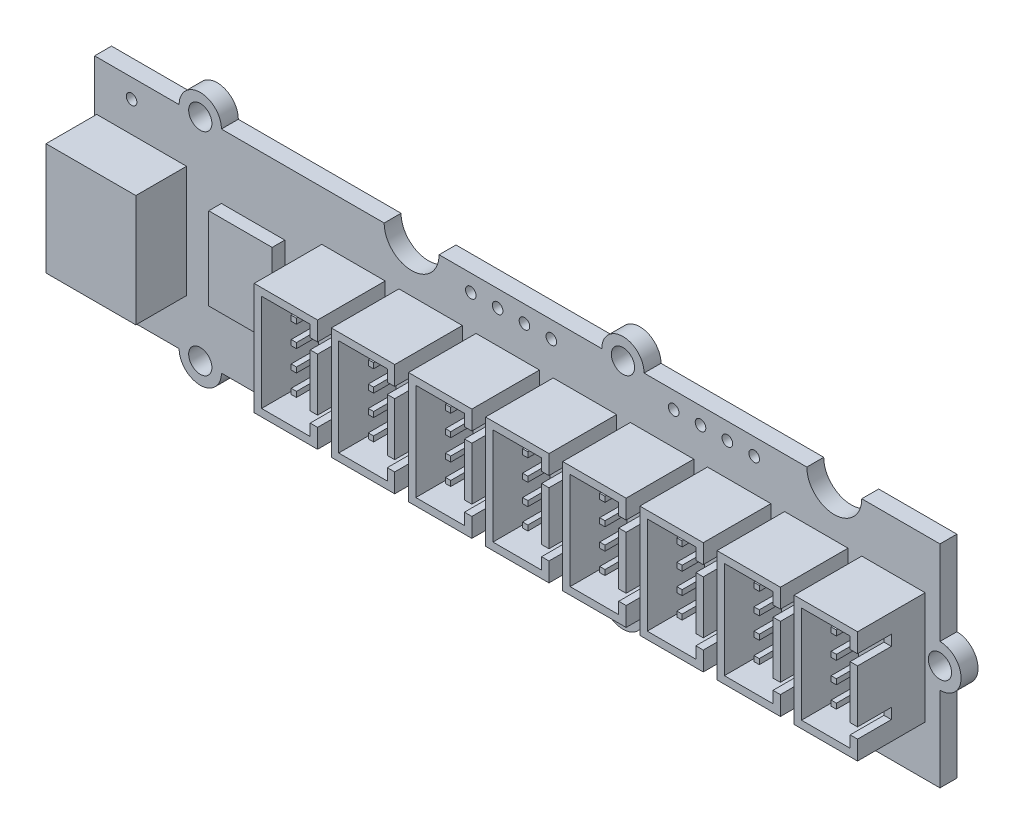
from build123d import *

# Parameters (mm, degrees)
ESQUISSE1_W                              = 80
ESQUISSE1_H                              = 20
PCB_80X20_EPAISSEUR_ESTIMEE_1_6_DEPTH    = 1.6
ESQUISSE2_R                              = 2
OREILLES_FIXATION_ESTIMEES_DEPTH         = 1.6
PERCAGES_D2_2_ET_ENCOCHES_ESTIMES_START  = 1.6
ESQUISSE3_R                              = 1.1
ESQUISSE3_R_2                            = 2.6
PERCAGES_D2_2_ET_ENCOCHES_ESTIMES_DEPTH  = 2
TROUS_AUXILIAIRES_ESTIMES_START          = 1.6
ESQUISSE4_R                              = 0.5
TROUS_AUXILIAIRES_ESTIMES_DEPTH          = 2
HUIT_CONNECTEURS_SORTIES_ESTIMES_START   = 1.6
ESQUISSE5_W                              = 6
ESQUISSE5_H                              = 10.6
HUIT_CONNECTEURS_SORTIES_ESTIMES_DEPTH   = 6.4
HUIT_CONNECTEURS_SORTIES_ESTIMES_2_DEPTH = 6.4
HUIT_CONNECTEURS_SORTIES_ESTIMES_3_DEPTH = 6.4
HUIT_CONNECTEURS_SORTIES_ESTIMES_4_DEPTH = 6.4
HUIT_CONNECTEURS_SORTIES_ESTIMES_5_DEPTH = 6.4
HUIT_CONNECTEURS_SORTIES_ESTIMES_6_DEPTH = 6.4
HUIT_CONNECTEURS_SORTIES_ESTIMES_7_DEPTH = 6.4
HUIT_CONNECTEURS_SORTIES_ESTIMES_8_DEPTH = 6.4
CAVITES_CONNECTEURS_START                = 8
ESQUISSE6_W                              = 4.6
ESQUISSE6_H                              = 9.2
CAVITES_CONNECTEURS_DEPTH                = 5.4
ENCOCHES_DETROMPAGE_SIMPLIFIEES_START    = 8
ESQUISSE7_W                              = 1
ESQUISSE7_H                              = 1
ENCOCHES_DETROMPAGE_SIMPLIFIEES_DEPTH    = 3.2
CONNECTEUR_ENTREE_COUDE_ESTIME_START     = 1.6
ESQUISSE8_W                              = 8.5
ESQUISSE8_H                              = 10.6
CONNECTEUR_ENTREE_COUDE_ESTIME_DEPTH     = 4.8
OUVERTURE_ENTREE_SIMPLIFIEE_START        = 5.7
ESQUISSE9_W                              = 6.6
ESQUISSE9_H                              = 9.2
OUVERTURE_ENTREE_SIMPLIFIEE_DEPTH        = 3.1
TCA9548A_BOITIER_SIMPLIFIE_START         = 1.6
ESQUISSE10_W                             = 6
ESQUISSE10_H                             = 7.8
TCA9548A_BOITIER_SIMPLIFIE_DEPTH         = 1.2
CONTACTS_SORTIES_PAS_2MM_START           = 2.6
ESQUISSE11_W                             = 0.5
ESQUISSE11_H                             = 0.5
CONTACTS_SORTIES_PAS_2MM_DEPTH           = 4.2
CONTACTS_SORTIES_PAS_2MM_2_DEPTH         = 4.2
CONTACTS_SORTIES_PAS_2MM_3_DEPTH         = 4.2
CONTACTS_SORTIES_PAS_2MM_4_DEPTH         = 4.2
CONTACTS_SORTIES_PAS_2MM_5_DEPTH         = 4.2
CONTACTS_SORTIES_PAS_2MM_6_DEPTH         = 4.2
CONTACTS_SORTIES_PAS_2MM_7_DEPTH         = 4.2
CONTACTS_SORTIES_PAS_2MM_8_DEPTH         = 4.2
CONTACTS_SORTIES_PAS_2MM_9_DEPTH         = 4.2
CONTACTS_SORTIES_PAS_2MM_10_DEPTH        = 4.2
CONTACTS_SORTIES_PAS_2MM_11_DEPTH        = 4.2
CONTACTS_SORTIES_PAS_2MM_12_DEPTH        = 4.2
CONTACTS_SORTIES_PAS_2MM_13_DEPTH        = 4.2
CONTACTS_SORTIES_PAS_2MM_14_DEPTH        = 4.2
CONTACTS_SORTIES_PAS_2MM_15_DEPTH        = 4.2
CONTACTS_SORTIES_PAS_2MM_16_DEPTH        = 4.2
CONTACTS_SORTIES_PAS_2MM_17_DEPTH        = 4.2
CONTACTS_SORTIES_PAS_2MM_18_DEPTH        = 4.2
CONTACTS_SORTIES_PAS_2MM_19_DEPTH        = 4.2
CONTACTS_SORTIES_PAS_2MM_20_DEPTH        = 4.2
CONTACTS_SORTIES_PAS_2MM_21_DEPTH        = 4.2
CONTACTS_SORTIES_PAS_2MM_22_DEPTH        = 4.2
CONTACTS_SORTIES_PAS_2MM_23_DEPTH        = 4.2
CONTACTS_SORTIES_PAS_2MM_24_DEPTH        = 4.2
CONTACTS_SORTIES_PAS_2MM_25_DEPTH        = 4.2
CONTACTS_SORTIES_PAS_2MM_26_DEPTH        = 4.2
CONTACTS_SORTIES_PAS_2MM_27_DEPTH        = 4.2
CONTACTS_SORTIES_PAS_2MM_28_DEPTH        = 4.2
CONTACTS_SORTIES_PAS_2MM_29_DEPTH        = 4.2
CONTACTS_SORTIES_PAS_2MM_30_DEPTH        = 4.2
CONTACTS_SORTIES_PAS_2MM_31_DEPTH        = 4.2
CONTACTS_SORTIES_PAS_2MM_32_DEPTH        = 4.2
CONTACTS_ENTREE_START                    = 3
ESQUISSE12_W                             = 5
ESQUISSE12_H                             = 0.5
CONTACTS_ENTREE_DEPTH                    = 0.5
CONTACTS_ENTREE_2_DEPTH                  = 0.5
CONTACTS_ENTREE_3_DEPTH                  = 0.5
CONTACTS_ENTREE_4_DEPTH                  = 0.5


with BuildPart() as part:
    # Esquisse1 → PCB_80x20_epaisseur_ESTIMEE_1_6 (new body)
    with BuildSketch(Plane.XY):
        with Locations((40, 10)):
            Rectangle(ESQUISSE1_W, ESQUISSE1_H)
    extrude(amount=PCB_80X20_EPAISSEUR_ESTIMEE_1_6_DEPTH)

    # Esquisse2 → Oreilles_fixation_ESTIMEES (add)
    with BuildSketch(Plane.XY):
        with Locations((10, 0)):
            Circle(ESQUISSE2_R)
        with Locations((10, 20)):
            Circle(ESQUISSE2_R)
        with Locations((50, 0)):
            Circle(ESQUISSE2_R)
        with Locations((50, 20)):
            Circle(ESQUISSE2_R)
        with Locations((80, 10)):
            Circle(ESQUISSE2_R)
    extrude(amount=OREILLES_FIXATION_ESTIMEES_DEPTH)

    # Esquisse3 → Percages_D2_2_et_encoches_ESTIMES (cut)
    with BuildSketch(Plane.XY.offset(PERCAGES_D2_2_ET_ENCOCHES_ESTIMES_START)):
        with Locations((10, 0)):
            Circle(ESQUISSE3_R)
        with Locations((10, 20)):
            Circle(ESQUISSE3_R)
        with Locations((50, 0)):
            Circle(ESQUISSE3_R)
        with Locations((50, 20)):
            Circle(ESQUISSE3_R)
        with Locations((80, 10)):
            Circle(ESQUISSE3_R)
        with Locations((30, 0)):
            Circle(ESQUISSE3_R_2)
        with Locations((30, 20)):
            Circle(ESQUISSE3_R_2)
        with Locations((70, 0)):
            Circle(ESQUISSE3_R_2)
        with Locations((70, 20)):
            Circle(ESQUISSE3_R_2)
        with Locations((0, 10)):
            Circle(ESQUISSE3_R_2)
    extrude(amount=-PERCAGES_D2_2_ET_ENCOCHES_ESTIMES_DEPTH, mode=Mode.SUBTRACT)

    # Esquisse4 → Trous_auxiliaires_ESTIMES (cut)
    with BuildSketch(Plane.XY.offset(TROUS_AUXILIAIRES_ESTIMES_START)):
        with Locations((35.6, 1.6)):
            Circle(ESQUISSE4_R)
        with Locations((35.6, 18.4)):
            Circle(ESQUISSE4_R)
        with Locations((38.14, 1.6)):
            Circle(ESQUISSE4_R)
        with Locations((38.14, 18.4)):
            Circle(ESQUISSE4_R)
        with Locations((40.68, 1.6)):
            Circle(ESQUISSE4_R)
        with Locations((40.68, 18.4)):
            Circle(ESQUISSE4_R)
        with Locations((43.22, 1.6)):
            Circle(ESQUISSE4_R)
        with Locations((43.22, 18.4)):
            Circle(ESQUISSE4_R)
        with Locations((54.8, 1.6)):
            Circle(ESQUISSE4_R)
        with Locations((54.8, 18.4)):
            Circle(ESQUISSE4_R)
        with Locations((57.34, 1.6)):
            Circle(ESQUISSE4_R)
        with Locations((57.34, 18.4)):
            Circle(ESQUISSE4_R)
        with Locations((59.88, 1.6)):
            Circle(ESQUISSE4_R)
        with Locations((59.88, 18.4)):
            Circle(ESQUISSE4_R)
        with Locations((62.42, 1.6)):
            Circle(ESQUISSE4_R)
        with Locations((62.42, 18.4)):
            Circle(ESQUISSE4_R)
        with Locations((3.5, 18.2)):
            Circle(ESQUISSE4_R)
    extrude(amount=-TROUS_AUXILIAIRES_ESTIMES_DEPTH, mode=Mode.SUBTRACT)


with BuildPart() as body_2:
    # Esquisse5 → Huit_connecteurs_sorties_ESTIMES (new body)
    with BuildSketch(Plane.XY.offset(HUIT_CONNECTEURS_SORTIES_ESTIMES_START)):
        with Locations((24.5, 10)):
            Rectangle(ESQUISSE5_W, ESQUISSE5_H)
    extrude(amount=HUIT_CONNECTEURS_SORTIES_ESTIMES_DEPTH)


with BuildPart() as body_3:
    # Esquisse5 → Huit_connecteurs_sorties_ESTIMES 2 (new body)
    with BuildSketch(Plane.XY.offset(HUIT_CONNECTEURS_SORTIES_ESTIMES_START)):
        with Locations((31.8, 10)):
            Rectangle(ESQUISSE5_W, ESQUISSE5_H)
    extrude(amount=HUIT_CONNECTEURS_SORTIES_ESTIMES_2_DEPTH)


with BuildPart() as body_4:
    # Esquisse5 → Huit_connecteurs_sorties_ESTIMES 3 (new body)
    with BuildSketch(Plane.XY.offset(HUIT_CONNECTEURS_SORTIES_ESTIMES_START)):
        with Locations((39.1, 10)):
            Rectangle(ESQUISSE5_W, ESQUISSE5_H)
    extrude(amount=HUIT_CONNECTEURS_SORTIES_ESTIMES_3_DEPTH)


with BuildPart() as body_5:
    # Esquisse5 → Huit_connecteurs_sorties_ESTIMES 4 (new body)
    with BuildSketch(Plane.XY.offset(HUIT_CONNECTEURS_SORTIES_ESTIMES_START)):
        with Locations((46.4, 10)):
            Rectangle(ESQUISSE5_W, ESQUISSE5_H)
    extrude(amount=HUIT_CONNECTEURS_SORTIES_ESTIMES_4_DEPTH)


with BuildPart() as body_6:
    # Esquisse5 → Huit_connecteurs_sorties_ESTIMES 5 (new body)
    with BuildSketch(Plane.XY.offset(HUIT_CONNECTEURS_SORTIES_ESTIMES_START)):
        with Locations((53.7, 10)):
            Rectangle(ESQUISSE5_W, ESQUISSE5_H)
    extrude(amount=HUIT_CONNECTEURS_SORTIES_ESTIMES_5_DEPTH)


with BuildPart() as body_7:
    # Esquisse5 → Huit_connecteurs_sorties_ESTIMES 6 (new body)
    with BuildSketch(Plane.XY.offset(HUIT_CONNECTEURS_SORTIES_ESTIMES_START)):
        with Locations((61, 10)):
            Rectangle(ESQUISSE5_W, ESQUISSE5_H)
    extrude(amount=HUIT_CONNECTEURS_SORTIES_ESTIMES_6_DEPTH)


with BuildPart() as body_8:
    # Esquisse5 → Huit_connecteurs_sorties_ESTIMES 7 (new body)
    with BuildSketch(Plane.XY.offset(HUIT_CONNECTEURS_SORTIES_ESTIMES_START)):
        with Locations((68.3, 10)):
            Rectangle(ESQUISSE5_W, ESQUISSE5_H)
    extrude(amount=HUIT_CONNECTEURS_SORTIES_ESTIMES_7_DEPTH)


with BuildPart() as body_9:
    # Esquisse5 → Huit_connecteurs_sorties_ESTIMES 8 (new body)
    with BuildSketch(Plane.XY.offset(HUIT_CONNECTEURS_SORTIES_ESTIMES_START)):
        with Locations((75.6, 10)):
            Rectangle(ESQUISSE5_W, ESQUISSE5_H)
    extrude(amount=HUIT_CONNECTEURS_SORTIES_ESTIMES_8_DEPTH)


with BuildPart() as cavites_connecteurs_tool:
    # Esquisse6 → Cavites_connecteurs (new body)
    with BuildSketch(Plane.XY.offset(CAVITES_CONNECTEURS_START)):
        with Locations((24.5, 10)):
            Rectangle(ESQUISSE6_W, ESQUISSE6_H)
        with Locations((31.8, 10)):
            Rectangle(ESQUISSE6_W, ESQUISSE6_H)
        with Locations((39.1, 10)):
            Rectangle(ESQUISSE6_W, ESQUISSE6_H)
        with Locations((46.4, 10)):
            Rectangle(ESQUISSE6_W, ESQUISSE6_H)
        with Locations((53.7, 10)):
            Rectangle(ESQUISSE6_W, ESQUISSE6_H)
        with Locations((61, 10)):
            Rectangle(ESQUISSE6_W, ESQUISSE6_H)
        with Locations((68.3, 10)):
            Rectangle(ESQUISSE6_W, ESQUISSE6_H)
        with Locations((75.6, 10)):
            Rectangle(ESQUISSE6_W, ESQUISSE6_H)
    extrude(amount=-CAVITES_CONNECTEURS_DEPTH)


with BuildPart() as body_2_1:
    add(body_2.part)

    # Cavites_connecteurs: cut by cavites_connecteurs_tool
    add(cavites_connecteurs_tool.part, mode=Mode.SUBTRACT)


with BuildPart() as body_3_1:
    add(body_3.part)

    # Cavites_connecteurs: cut by cavites_connecteurs_tool
    add(cavites_connecteurs_tool.part, mode=Mode.SUBTRACT)


with BuildPart() as body_4_1:
    add(body_4.part)

    # Cavites_connecteurs: cut by cavites_connecteurs_tool
    add(cavites_connecteurs_tool.part, mode=Mode.SUBTRACT)


with BuildPart() as body_5_1:
    add(body_5.part)

    # Cavites_connecteurs: cut by cavites_connecteurs_tool
    add(cavites_connecteurs_tool.part, mode=Mode.SUBTRACT)


with BuildPart() as body_6_1:
    add(body_6.part)

    # Cavites_connecteurs: cut by cavites_connecteurs_tool
    add(cavites_connecteurs_tool.part, mode=Mode.SUBTRACT)


with BuildPart() as body_7_1:
    add(body_7.part)

    # Cavites_connecteurs: cut by cavites_connecteurs_tool
    add(cavites_connecteurs_tool.part, mode=Mode.SUBTRACT)


with BuildPart() as body_8_1:
    add(body_8.part)

    # Cavites_connecteurs: cut by cavites_connecteurs_tool
    add(cavites_connecteurs_tool.part, mode=Mode.SUBTRACT)


with BuildPart() as body_9_1:
    add(body_9.part)

    # Cavites_connecteurs: cut by cavites_connecteurs_tool
    add(cavites_connecteurs_tool.part, mode=Mode.SUBTRACT)


with BuildPart() as encoches_detrompage_simplifiees_tool:
    # Esquisse7 → Encoches_detrompage_simplifiees (new body)
    with BuildSketch(Plane.XY.offset(ENCOCHES_DETROMPAGE_SIMPLIFIEES_START)):
        with Locations((27.2, 7)):
            Rectangle(ESQUISSE7_W, ESQUISSE7_H)
        with Locations((27.2, 13)):
            Rectangle(ESQUISSE7_W, ESQUISSE7_H)
        with Locations((34.5, 7)):
            Rectangle(ESQUISSE7_W, ESQUISSE7_H)
        with Locations((34.5, 13)):
            Rectangle(ESQUISSE7_W, ESQUISSE7_H)
        with Locations((41.8, 7)):
            Rectangle(ESQUISSE7_W, ESQUISSE7_H)
        with Locations((41.8, 13)):
            Rectangle(ESQUISSE7_W, ESQUISSE7_H)
        with Locations((49.1, 7)):
            Rectangle(ESQUISSE7_W, ESQUISSE7_H)
        with Locations((49.1, 13)):
            Rectangle(ESQUISSE7_W, ESQUISSE7_H)
        with Locations((56.4, 7)):
            Rectangle(ESQUISSE7_W, ESQUISSE7_H)
        with Locations((56.4, 13)):
            Rectangle(ESQUISSE7_W, ESQUISSE7_H)
        with Locations((63.7, 7)):
            Rectangle(ESQUISSE7_W, ESQUISSE7_H)
        with Locations((63.7, 13)):
            Rectangle(ESQUISSE7_W, ESQUISSE7_H)
        with Locations((71, 7)):
            Rectangle(ESQUISSE7_W, ESQUISSE7_H)
        with Locations((71, 13)):
            Rectangle(ESQUISSE7_W, ESQUISSE7_H)
        with Locations((78.3, 7)):
            Rectangle(ESQUISSE7_W, ESQUISSE7_H)
        with Locations((78.3, 13)):
            Rectangle(ESQUISSE7_W, ESQUISSE7_H)
    extrude(amount=-ENCOCHES_DETROMPAGE_SIMPLIFIEES_DEPTH)


with BuildPart() as body_2_2:
    add(body_2_1.part)

    # Encoches_detrompage_simplifiees: cut by encoches_detrompage_simplifiees_tool
    add(encoches_detrompage_simplifiees_tool.part, mode=Mode.SUBTRACT)


with BuildPart() as body_3_2:
    add(body_3_1.part)

    # Encoches_detrompage_simplifiees: cut by encoches_detrompage_simplifiees_tool
    add(encoches_detrompage_simplifiees_tool.part, mode=Mode.SUBTRACT)


with BuildPart() as body_4_2:
    add(body_4_1.part)

    # Encoches_detrompage_simplifiees: cut by encoches_detrompage_simplifiees_tool
    add(encoches_detrompage_simplifiees_tool.part, mode=Mode.SUBTRACT)


with BuildPart() as body_5_2:
    add(body_5_1.part)

    # Encoches_detrompage_simplifiees: cut by encoches_detrompage_simplifiees_tool
    add(encoches_detrompage_simplifiees_tool.part, mode=Mode.SUBTRACT)


with BuildPart() as body_6_2:
    add(body_6_1.part)

    # Encoches_detrompage_simplifiees: cut by encoches_detrompage_simplifiees_tool
    add(encoches_detrompage_simplifiees_tool.part, mode=Mode.SUBTRACT)


with BuildPart() as body_7_2:
    add(body_7_1.part)

    # Encoches_detrompage_simplifiees: cut by encoches_detrompage_simplifiees_tool
    add(encoches_detrompage_simplifiees_tool.part, mode=Mode.SUBTRACT)


with BuildPart() as body_8_2:
    add(body_8_1.part)

    # Encoches_detrompage_simplifiees: cut by encoches_detrompage_simplifiees_tool
    add(encoches_detrompage_simplifiees_tool.part, mode=Mode.SUBTRACT)


with BuildPart() as body_9_2:
    add(body_9_1.part)

    # Encoches_detrompage_simplifiees: cut by encoches_detrompage_simplifiees_tool
    add(encoches_detrompage_simplifiees_tool.part, mode=Mode.SUBTRACT)


with BuildPart() as body_10:
    # Esquisse8 → Connecteur_entree_coude_ESTIME (new body)
    with BuildSketch(Plane.XY.offset(CONNECTEUR_ENTREE_COUDE_ESTIME_START)):
        with Locations((4.45, 10)):
            Rectangle(ESQUISSE8_W, ESQUISSE8_H)
    extrude(amount=CONNECTEUR_ENTREE_COUDE_ESTIME_DEPTH)

    # Esquisse9 → Ouverture_entree_simplifiee (cut)
    with BuildSketch(Plane.XY.offset(OUVERTURE_ENTREE_SIMPLIFIEE_START)):
        with Locations((2.8, 10)):
            Rectangle(ESQUISSE9_W, ESQUISSE9_H)
    extrude(amount=-OUVERTURE_ENTREE_SIMPLIFIEE_DEPTH, mode=Mode.SUBTRACT)


with BuildPart() as body_11:
    # Esquisse10 → TCA9548A_boitier_simplifie (new body)
    with BuildSketch(Plane.XY.offset(TCA9548A_BOITIER_SIMPLIFIE_START)):
        with Locations((15, 10)):
            Rectangle(ESQUISSE10_W, ESQUISSE10_H)
    extrude(amount=TCA9548A_BOITIER_SIMPLIFIE_DEPTH)


with BuildPart() as body_12:
    # Esquisse11 → Contacts_sorties_pas_2mm (new body)
    with BuildSketch(Plane.XY.offset(CONTACTS_SORTIES_PAS_2MM_START)):
        with Locations((24.05, 7)):
            Rectangle(ESQUISSE11_W, ESQUISSE11_H)
    extrude(amount=CONTACTS_SORTIES_PAS_2MM_DEPTH)


with BuildPart() as body_13:
    # Esquisse11 → Contacts_sorties_pas_2mm 2 (new body)
    with BuildSketch(Plane.XY.offset(CONTACTS_SORTIES_PAS_2MM_START)):
        with Locations((24.05, 9)):
            Rectangle(ESQUISSE11_W, ESQUISSE11_H)
    extrude(amount=CONTACTS_SORTIES_PAS_2MM_2_DEPTH)


with BuildPart() as body_14:
    # Esquisse11 → Contacts_sorties_pas_2mm 3 (new body)
    with BuildSketch(Plane.XY.offset(CONTACTS_SORTIES_PAS_2MM_START)):
        with Locations((24.05, 11)):
            Rectangle(ESQUISSE11_W, ESQUISSE11_H)
    extrude(amount=CONTACTS_SORTIES_PAS_2MM_3_DEPTH)


with BuildPart() as body_15:
    # Esquisse11 → Contacts_sorties_pas_2mm 4 (new body)
    with BuildSketch(Plane.XY.offset(CONTACTS_SORTIES_PAS_2MM_START)):
        with Locations((24.05, 13)):
            Rectangle(ESQUISSE11_W, ESQUISSE11_H)
    extrude(amount=CONTACTS_SORTIES_PAS_2MM_4_DEPTH)


with BuildPart() as body_16:
    # Esquisse11 → Contacts_sorties_pas_2mm 5 (new body)
    with BuildSketch(Plane.XY.offset(CONTACTS_SORTIES_PAS_2MM_START)):
        with Locations((31.35, 7)):
            Rectangle(ESQUISSE11_W, ESQUISSE11_H)
    extrude(amount=CONTACTS_SORTIES_PAS_2MM_5_DEPTH)


with BuildPart() as body_17:
    # Esquisse11 → Contacts_sorties_pas_2mm 6 (new body)
    with BuildSketch(Plane.XY.offset(CONTACTS_SORTIES_PAS_2MM_START)):
        with Locations((31.35, 9)):
            Rectangle(ESQUISSE11_W, ESQUISSE11_H)
    extrude(amount=CONTACTS_SORTIES_PAS_2MM_6_DEPTH)


with BuildPart() as body_18:
    # Esquisse11 → Contacts_sorties_pas_2mm 7 (new body)
    with BuildSketch(Plane.XY.offset(CONTACTS_SORTIES_PAS_2MM_START)):
        with Locations((31.35, 11)):
            Rectangle(ESQUISSE11_W, ESQUISSE11_H)
    extrude(amount=CONTACTS_SORTIES_PAS_2MM_7_DEPTH)


with BuildPart() as body_19:
    # Esquisse11 → Contacts_sorties_pas_2mm 8 (new body)
    with BuildSketch(Plane.XY.offset(CONTACTS_SORTIES_PAS_2MM_START)):
        with Locations((31.35, 13)):
            Rectangle(ESQUISSE11_W, ESQUISSE11_H)
    extrude(amount=CONTACTS_SORTIES_PAS_2MM_8_DEPTH)


with BuildPart() as body_20:
    # Esquisse11 → Contacts_sorties_pas_2mm 9 (new body)
    with BuildSketch(Plane.XY.offset(CONTACTS_SORTIES_PAS_2MM_START)):
        with Locations((38.65, 7)):
            Rectangle(ESQUISSE11_W, ESQUISSE11_H)
    extrude(amount=CONTACTS_SORTIES_PAS_2MM_9_DEPTH)


with BuildPart() as body_21:
    # Esquisse11 → Contacts_sorties_pas_2mm 10 (new body)
    with BuildSketch(Plane.XY.offset(CONTACTS_SORTIES_PAS_2MM_START)):
        with Locations((38.65, 9)):
            Rectangle(ESQUISSE11_W, ESQUISSE11_H)
    extrude(amount=CONTACTS_SORTIES_PAS_2MM_10_DEPTH)


with BuildPart() as body_22:
    # Esquisse11 → Contacts_sorties_pas_2mm 11 (new body)
    with BuildSketch(Plane.XY.offset(CONTACTS_SORTIES_PAS_2MM_START)):
        with Locations((38.65, 11)):
            Rectangle(ESQUISSE11_W, ESQUISSE11_H)
    extrude(amount=CONTACTS_SORTIES_PAS_2MM_11_DEPTH)


with BuildPart() as body_23:
    # Esquisse11 → Contacts_sorties_pas_2mm 12 (new body)
    with BuildSketch(Plane.XY.offset(CONTACTS_SORTIES_PAS_2MM_START)):
        with Locations((38.65, 13)):
            Rectangle(ESQUISSE11_W, ESQUISSE11_H)
    extrude(amount=CONTACTS_SORTIES_PAS_2MM_12_DEPTH)


with BuildPart() as body_24:
    # Esquisse11 → Contacts_sorties_pas_2mm 13 (new body)
    with BuildSketch(Plane.XY.offset(CONTACTS_SORTIES_PAS_2MM_START)):
        with Locations((45.95, 7)):
            Rectangle(ESQUISSE11_W, ESQUISSE11_H)
    extrude(amount=CONTACTS_SORTIES_PAS_2MM_13_DEPTH)


with BuildPart() as body_25:
    # Esquisse11 → Contacts_sorties_pas_2mm 14 (new body)
    with BuildSketch(Plane.XY.offset(CONTACTS_SORTIES_PAS_2MM_START)):
        with Locations((45.95, 9)):
            Rectangle(ESQUISSE11_W, ESQUISSE11_H)
    extrude(amount=CONTACTS_SORTIES_PAS_2MM_14_DEPTH)


with BuildPart() as body_26:
    # Esquisse11 → Contacts_sorties_pas_2mm 15 (new body)
    with BuildSketch(Plane.XY.offset(CONTACTS_SORTIES_PAS_2MM_START)):
        with Locations((45.95, 11)):
            Rectangle(ESQUISSE11_W, ESQUISSE11_H)
    extrude(amount=CONTACTS_SORTIES_PAS_2MM_15_DEPTH)


with BuildPart() as body_27:
    # Esquisse11 → Contacts_sorties_pas_2mm 16 (new body)
    with BuildSketch(Plane.XY.offset(CONTACTS_SORTIES_PAS_2MM_START)):
        with Locations((45.95, 13)):
            Rectangle(ESQUISSE11_W, ESQUISSE11_H)
    extrude(amount=CONTACTS_SORTIES_PAS_2MM_16_DEPTH)


with BuildPart() as body_28:
    # Esquisse11 → Contacts_sorties_pas_2mm 17 (new body)
    with BuildSketch(Plane.XY.offset(CONTACTS_SORTIES_PAS_2MM_START)):
        with Locations((53.25, 7)):
            Rectangle(ESQUISSE11_W, ESQUISSE11_H)
    extrude(amount=CONTACTS_SORTIES_PAS_2MM_17_DEPTH)


with BuildPart() as body_29:
    # Esquisse11 → Contacts_sorties_pas_2mm 18 (new body)
    with BuildSketch(Plane.XY.offset(CONTACTS_SORTIES_PAS_2MM_START)):
        with Locations((53.25, 9)):
            Rectangle(ESQUISSE11_W, ESQUISSE11_H)
    extrude(amount=CONTACTS_SORTIES_PAS_2MM_18_DEPTH)


with BuildPart() as body_30:
    # Esquisse11 → Contacts_sorties_pas_2mm 19 (new body)
    with BuildSketch(Plane.XY.offset(CONTACTS_SORTIES_PAS_2MM_START)):
        with Locations((53.25, 11)):
            Rectangle(ESQUISSE11_W, ESQUISSE11_H)
    extrude(amount=CONTACTS_SORTIES_PAS_2MM_19_DEPTH)


with BuildPart() as body_31:
    # Esquisse11 → Contacts_sorties_pas_2mm 20 (new body)
    with BuildSketch(Plane.XY.offset(CONTACTS_SORTIES_PAS_2MM_START)):
        with Locations((53.25, 13)):
            Rectangle(ESQUISSE11_W, ESQUISSE11_H)
    extrude(amount=CONTACTS_SORTIES_PAS_2MM_20_DEPTH)


with BuildPart() as body_32:
    # Esquisse11 → Contacts_sorties_pas_2mm 21 (new body)
    with BuildSketch(Plane.XY.offset(CONTACTS_SORTIES_PAS_2MM_START)):
        with Locations((60.55, 7)):
            Rectangle(ESQUISSE11_W, ESQUISSE11_H)
    extrude(amount=CONTACTS_SORTIES_PAS_2MM_21_DEPTH)


with BuildPart() as body_33:
    # Esquisse11 → Contacts_sorties_pas_2mm 22 (new body)
    with BuildSketch(Plane.XY.offset(CONTACTS_SORTIES_PAS_2MM_START)):
        with Locations((60.55, 9)):
            Rectangle(ESQUISSE11_W, ESQUISSE11_H)
    extrude(amount=CONTACTS_SORTIES_PAS_2MM_22_DEPTH)


with BuildPart() as body_34:
    # Esquisse11 → Contacts_sorties_pas_2mm 23 (new body)
    with BuildSketch(Plane.XY.offset(CONTACTS_SORTIES_PAS_2MM_START)):
        with Locations((60.55, 11)):
            Rectangle(ESQUISSE11_W, ESQUISSE11_H)
    extrude(amount=CONTACTS_SORTIES_PAS_2MM_23_DEPTH)


with BuildPart() as body_35:
    # Esquisse11 → Contacts_sorties_pas_2mm 24 (new body)
    with BuildSketch(Plane.XY.offset(CONTACTS_SORTIES_PAS_2MM_START)):
        with Locations((60.55, 13)):
            Rectangle(ESQUISSE11_W, ESQUISSE11_H)
    extrude(amount=CONTACTS_SORTIES_PAS_2MM_24_DEPTH)


with BuildPart() as body_36:
    # Esquisse11 → Contacts_sorties_pas_2mm 25 (new body)
    with BuildSketch(Plane.XY.offset(CONTACTS_SORTIES_PAS_2MM_START)):
        with Locations((67.85, 7)):
            Rectangle(ESQUISSE11_W, ESQUISSE11_H)
    extrude(amount=CONTACTS_SORTIES_PAS_2MM_25_DEPTH)


with BuildPart() as body_37:
    # Esquisse11 → Contacts_sorties_pas_2mm 26 (new body)
    with BuildSketch(Plane.XY.offset(CONTACTS_SORTIES_PAS_2MM_START)):
        with Locations((67.85, 9)):
            Rectangle(ESQUISSE11_W, ESQUISSE11_H)
    extrude(amount=CONTACTS_SORTIES_PAS_2MM_26_DEPTH)


with BuildPart() as body_38:
    # Esquisse11 → Contacts_sorties_pas_2mm 27 (new body)
    with BuildSketch(Plane.XY.offset(CONTACTS_SORTIES_PAS_2MM_START)):
        with Locations((67.85, 11)):
            Rectangle(ESQUISSE11_W, ESQUISSE11_H)
    extrude(amount=CONTACTS_SORTIES_PAS_2MM_27_DEPTH)


with BuildPart() as body_39:
    # Esquisse11 → Contacts_sorties_pas_2mm 28 (new body)
    with BuildSketch(Plane.XY.offset(CONTACTS_SORTIES_PAS_2MM_START)):
        with Locations((67.85, 13)):
            Rectangle(ESQUISSE11_W, ESQUISSE11_H)
    extrude(amount=CONTACTS_SORTIES_PAS_2MM_28_DEPTH)


with BuildPart() as body_40:
    # Esquisse11 → Contacts_sorties_pas_2mm 29 (new body)
    with BuildSketch(Plane.XY.offset(CONTACTS_SORTIES_PAS_2MM_START)):
        with Locations((75.15, 7)):
            Rectangle(ESQUISSE11_W, ESQUISSE11_H)
    extrude(amount=CONTACTS_SORTIES_PAS_2MM_29_DEPTH)


with BuildPart() as body_41:
    # Esquisse11 → Contacts_sorties_pas_2mm 30 (new body)
    with BuildSketch(Plane.XY.offset(CONTACTS_SORTIES_PAS_2MM_START)):
        with Locations((75.15, 9)):
            Rectangle(ESQUISSE11_W, ESQUISSE11_H)
    extrude(amount=CONTACTS_SORTIES_PAS_2MM_30_DEPTH)


with BuildPart() as body_42:
    # Esquisse11 → Contacts_sorties_pas_2mm 31 (new body)
    with BuildSketch(Plane.XY.offset(CONTACTS_SORTIES_PAS_2MM_START)):
        with Locations((75.15, 11)):
            Rectangle(ESQUISSE11_W, ESQUISSE11_H)
    extrude(amount=CONTACTS_SORTIES_PAS_2MM_31_DEPTH)


with BuildPart() as body_43:
    # Esquisse11 → Contacts_sorties_pas_2mm 32 (new body)
    with BuildSketch(Plane.XY.offset(CONTACTS_SORTIES_PAS_2MM_START)):
        with Locations((75.15, 13)):
            Rectangle(ESQUISSE11_W, ESQUISSE11_H)
    extrude(amount=CONTACTS_SORTIES_PAS_2MM_32_DEPTH)


with BuildPart() as body_44:
    # Esquisse12 → Contacts_entree (new body)
    with BuildSketch(Plane.XY.offset(CONTACTS_ENTREE_START)):
        with Locations((4, 7)):
            Rectangle(ESQUISSE12_W, ESQUISSE12_H)
    extrude(amount=CONTACTS_ENTREE_DEPTH)


with BuildPart() as body_45:
    # Esquisse12 → Contacts_entree 2 (new body)
    with BuildSketch(Plane.XY.offset(CONTACTS_ENTREE_START)):
        with Locations((4, 9)):
            Rectangle(ESQUISSE12_W, ESQUISSE12_H)
    extrude(amount=CONTACTS_ENTREE_2_DEPTH)


with BuildPart() as body_46:
    # Esquisse12 → Contacts_entree 3 (new body)
    with BuildSketch(Plane.XY.offset(CONTACTS_ENTREE_START)):
        with Locations((4, 11)):
            Rectangle(ESQUISSE12_W, ESQUISSE12_H)
    extrude(amount=CONTACTS_ENTREE_3_DEPTH)


with BuildPart() as body_47:
    # Esquisse12 → Contacts_entree 4 (new body)
    with BuildSketch(Plane.XY.offset(CONTACTS_ENTREE_START)):
        with Locations((4, 13)):
            Rectangle(ESQUISSE12_W, ESQUISSE12_H)
    extrude(amount=CONTACTS_ENTREE_4_DEPTH)


solid = Compound([part.part, body_2_2.part, body_3_2.part, body_4_2.part, body_5_2.part, body_6_2.part, body_7_2.part, body_8_2.part, body_9_2.part, body_10.part, body_11.part, body_12.part, body_13.part, body_14.part, body_15.part, body_16.part, body_17.part, body_18.part, body_19.part, body_20.part, body_21.part, body_22.part, body_23.part, body_24.part, body_25.part, body_26.part, body_27.part, body_28.part, body_29.part, body_30.part, body_31.part, body_32.part, body_33.part, body_34.part, body_35.part, body_36.part, body_37.part, body_38.part, body_39.part, body_40.part, body_41.part, body_42.part, body_43.part, body_44.part, body_45.part, body_46.part, body_47.part])
